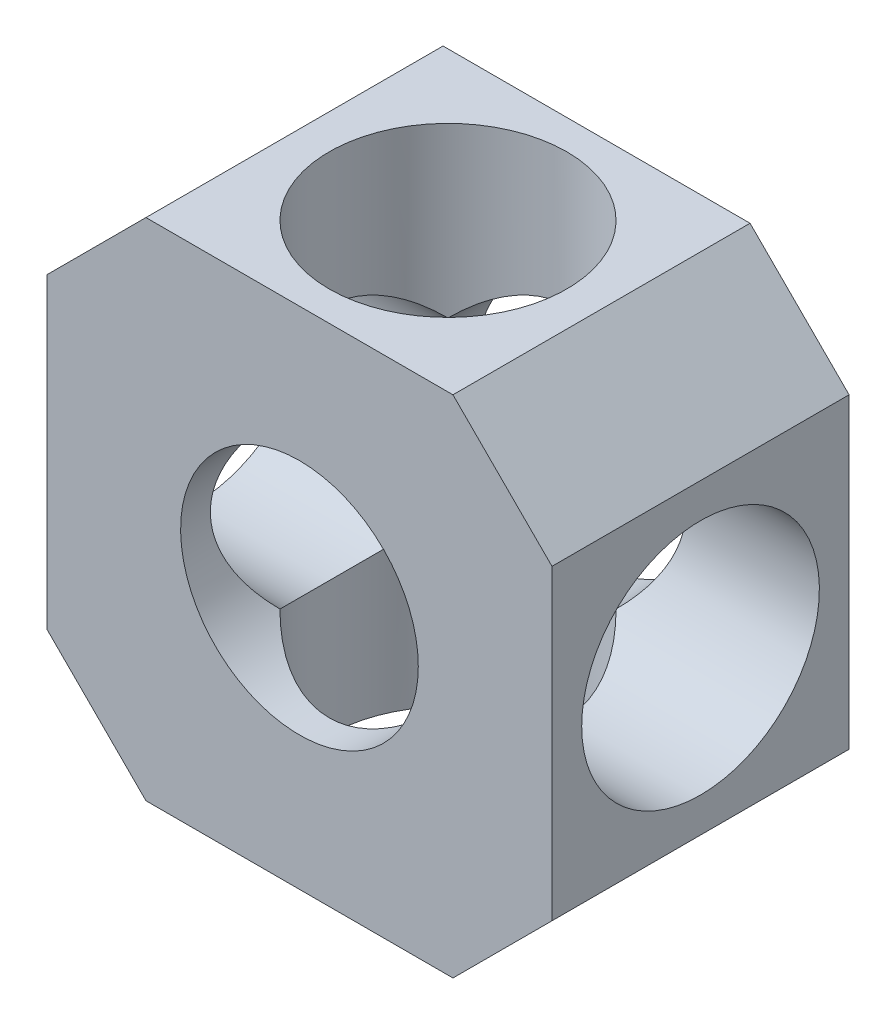
from build123d import *

# Parameters (mm, degrees)
SKETCH1_R           = 6
BOSS_EXTRUDE1_DEPTH = 7.5
SKETCH3_R           = 6
CUT_EXTRUDE1_DEPTH  = 30.479866011
CIRPATTERN1_COUNT   = 4
SCALE1_SCALE        = 0.828947368


with BuildPart() as part:
    # Sketch1 → Boss-Extrude1 (new, symmetric)
    with BuildSketch(Plane.XY):
        Polygon((-12.75, 7.75), (-7.75, 12.75), (7.75, 12.75), (12.75, 7.75), (12.75, -7.75), (7.75, -12.75), (-7.75, -12.75), (-12.75, -7.75), align=None)
        Circle(SKETCH1_R, mode=Mode.SUBTRACT)
    extrude(amount=BOSS_EXTRUDE1_DEPTH, both=True)

    # Sketch3 → Cut-Extrude1 (cut, through all)
    with BuildSketch(Plane(origin=(0, 12.75, 0), x_dir=(1, 0, 0), z_dir=(0, 1, 0))):
        with Locations(Location((0, 0, 0), (0, 0, 270))):
            Circle(SKETCH3_R)
    cut_extrude1 = extrude(amount=-CUT_EXTRUDE1_DEPTH, mode=Mode.SUBTRACT)

    # CirPattern1: Cut-Extrude1 ×4 about axis
    cirpattern1_axis = Axis((0, 0, 7.5), (0, 0, -1))
    for i in range(1, CIRPATTERN1_COUNT):
        add(cut_extrude1.rotate(cirpattern1_axis, i * 360 / CIRPATTERN1_COUNT), mode=Mode.SUBTRACT)


with BuildPart() as part_1:
    # Scale1: scaled about (0, 0, 0)
    add(part.part.scale(SCALE1_SCALE))


solid = part_1.part
